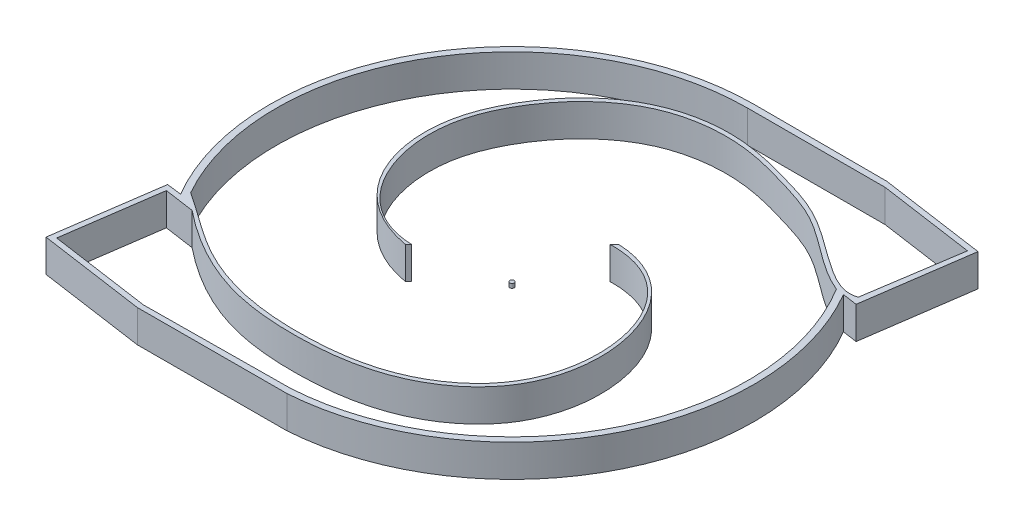
from build123d import *

# Parameters (mm, degrees)
SALIENTE_EXTRUIR1_DEPTH = 15
CROQUIS2_R              = 1
SALIENTE_EXTRUIR2_DEPTH = 2


with BuildPart() as part:
    # Croquis1 → Saliente-Extruir1 (new body)
    with BuildSketch(Plane(origin=(0, 0, 0), x_dir=(1, 0, 0), z_dir=(0, 1, 0))):
        with BuildLine():
            Line((0.216172516, 112.499792308), (61.60620497, 112.381829088))
            Line((61.60620497, 112.381829088), (111.098134085, 105.272050436))
            Line((111.098134085, 105.272050436), (103.988355432, 55.780121321))
            Line((103.988355432, 55.780121321), (97.128353147, 56.765597108))
            ThreePointArc((97.128353147, 56.765597108), (99.463190724, -52.567325318), (7.813304366, -112.228348802))
            Line((7.813304366, -112.228348802), (-61.60620497, -112.381829088))
            Line((-61.60620497, -112.381829088), (-111.098134085, -105.272050436))
            Line((-111.098134085, -105.272050436), (-104.005429548, -55.898976068))
            Line((-104.005429548, -55.898976068), (-97.128353147, -56.765597108))
            ThreePointArc((-97.128353147, -56.765597108), (-97.522744538, 56.085330504), (0.216172516, 112.499792308))
        make_face()
        with BuildLine():
            Line((-0.088849876, 109.499963953), (24.748737342, 109.520117535))
            Line((24.748737342, 109.520117535), (63.725312493, 109.5517437))
            Line((63.725312493, 109.5517437), (108.356962434, 103.140169982))
            Line((108.356962434, 103.140169982), (101.65111298, 59.221092328))
            add(Edge.make_bspline(
                [(101.65111298, 59.221092328), (91.038420904, 54.839363344), (67.350442567, 81.849723714), (38.853683473, 89.141317209), (40.372534331, 88.677429483), (10.898716902, 98.152644049), (-30.720622151, 90.556775662), (-54.932271839, 63.385574647), (-72.302139649, 19.824987315), (-57.608852294, -18.867382229), (-24.748737342, -24.748737342)],
                knots=[0, 0, 0, 0, 0.18013379, 0.261356163, 0.280027326, 0.366845423, 0.472528245, 0.63772993, 0.722543072, 1, 1, 1, 1], degree=3))
            Line((-24.748737342, -24.748737342), (-23.334523779, -23.334523779))
            add(Edge.make_bspline(
                [(-23.334523779, -23.334523779), (-53.14286993, -22.192828556), (-70.92864095, 17.773291113), (-52.97081379, 63.403091334), (-26.351120267, 90.764605943), (11.754483733, 95.023327898), (37.403272998, 87.799607068), (65.322911504, 78.768171949), (79.999859793, 62.784868706), (93.301684186, 57.315318442)],
                knots=[0, 0, 0, 0, 0.28477642, 0.367115198, 0.543282986, 0.675927183, 0.771893637, 0.839956883, 1, 1, 1, 1], degree=3))
            ThreePointArc((93.301684186, 57.315318442), (97.119103396, -50.577957209), (6.528584444, -109.305203834))
            Line((6.528584444, -109.305203834), (-61.25071602, -109.907232515))
            Line((-61.25071602, -109.907232515), (-108.268048696, -103.152942912))
            Line((-108.268048696, -103.152942912), (-101.869247909, -58.610206709))
            Line((-101.869247909, -58.610206709), (-87.916361503, -60.614612997))
            add(Edge.make_bspline(
                [(24.748737342, 24.748737342), (51.737058974, 23.662169671), (72.116083669, -11.817042893), (59.786280923, -59.014924598), (28.209040086, -83.035288914), (-9.822611152, -88.338825627), (-51.58642809, -84.753416868), (-75.972753665, -70.291855963), (-87.916361503, -60.614612997)],
                knots=[0, 0, 0, 0, 0.260567981, 0.392123415, 0.526871299, 0.686922119, 0.822471855, 1, 1, 1, 1], degree=3))
            Line((24.748737342, 24.748737342), (22.748737342, 22.748737342))
            add(Edge.make_bspline(
                [(22.748737342, 22.748737342), (50.56906237, 23.495909323), (70.083190632, -11.197214676), (58.348929293, -57.659381069), (27.696034777, -80.995188885), (-9.763795039, -86.36173634), (-42.290075397, -83.597289835), (-71.217723861, -72.03341753), (-85.595236891, -60.159909573), (-95.32184089, -53.888743253)],
                knots=[0, 0, 0, 0, 0.249249862, 0.376491623, 0.507985439, 0.654061849, 0.793176367, 0.869807124, 1, 1, 1, 1], degree=3))
            ThreePointArc((-95.32184089, -53.888743253), (-94.603210245, 55.140571373), (-0.088849876, 109.499963953))
        make_face(mode=Mode.SUBTRACT)
    extrude(amount=SALIENTE_EXTRUIR1_DEPTH)


with BuildPart() as body_2:
    # Croquis2 → Saliente-Extruir2 (new body)
    with BuildSketch(Plane.XZ):
        with Locations(Location((0, 0, 0), (0, 0, 270))):
            Circle(CROQUIS2_R)
    extrude(amount=SALIENTE_EXTRUIR2_DEPTH)


solid = Compound([part.part, body_2.part])
